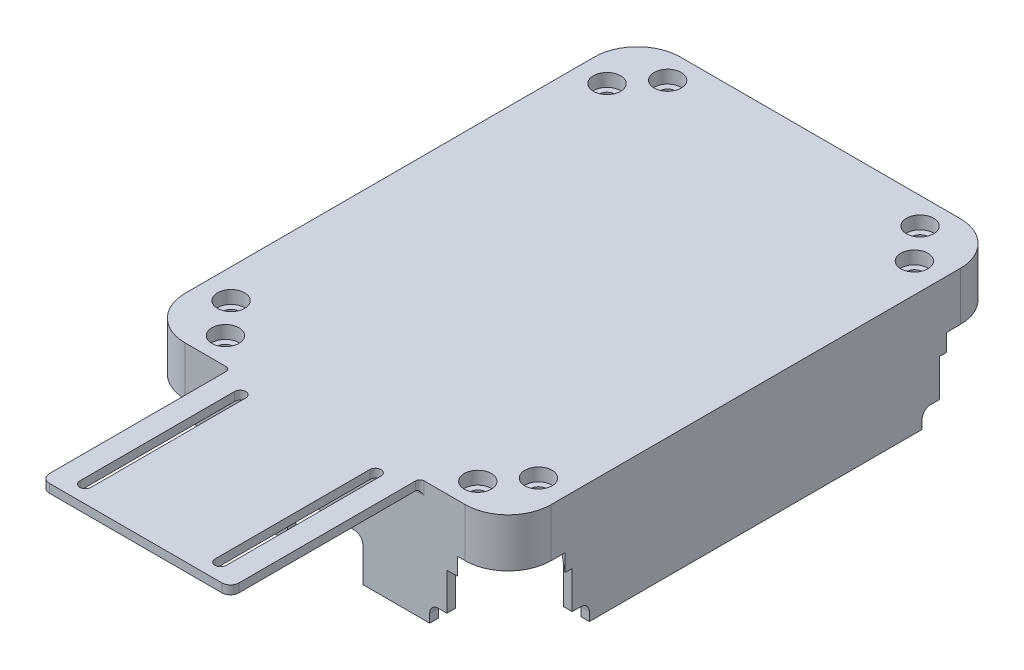
from build123d import *

# Parameters (mm, degrees)
SKETCH1_W               = 107.95
SKETCH1_H               = 146.05
BOSS_EXTRUDE1_DEPTH     = 2.54
SKETCH13_W              = 25.4
SKETCH13_H              = 25.4
BOSS_EXTRUDE4_DEPTH     = 19.431
SKETCH2_R               = 3.302
CUT_EXTRUDE1_DEPTH      = 93.862882849
FILLET1_R               = 12.7
CUT_EXTRUDE13_DEPTH     = 5.08
SKETCH15_R              = 5.08
BOSS_EXTRUDE5_DEPTH     = 11.811
SKETCH23_R              = 2.25
CUT_EXTRUDE14_DEPTH     = 92.934228941
SKETCH24_R              = 4
CUT_EXTRUDE15_DEPTH     = 3.81
MIRROR2_COPY_1_SKETCH_R = 2.25
MIRROR2_COPY_1_DEPTH    = 92.934228941
MIRROR2_COPY_2_SKETCH_R = 4
MIRROR2_COPY_2_DEPTH    = 3.81
FILLET3_R               = 12.7
FILLET4_R               = 1.016
SKETCH27_W              = 71.841582164
SKETCH27_H              = 2.54
SKETCH27_W_2            = 2.54
SKETCH27_H_2            = 108.293882364
BOSS_EXTRUDE6_DEPTH     = 32.98825
CUT_EXTRUDE16_DEPTH     = 41.656
CUT_EXTRUDE17_DEPTH     = 136.085564266
CUT_EXTRUDE18_DEPTH     = 160.706479747
CUT_EXTRUDE19_REACH     = 161.706
SKETCH31_W              = 22.225
SKETCH31_H              = 12.7
FILLET5_R               = 2.54
BOSS_EXTRUDE7_DEPTH     = 2.54
FILLET6_R               = 1.27
FILLET7_R               = 1.27


with BuildPart() as part:
    # Sketch1 → Boss-Extrude1 (new body)
    with BuildSketch(Plane(origin=(0, 0, 0), x_dir=(1, 0, 0), z_dir=(0, 1, 0))):
        Rectangle(SKETCH1_W, SKETCH1_H)
    extrude(amount=-BOSS_EXTRUDE1_DEPTH)

    # Sketch13 → Boss-Extrude4 (add)
    with BuildSketch(Plane(origin=(0, 0, 0), x_dir=(1, 0, 0), z_dir=(0, 1, 0))):
        with Locations((41.275, -60.325)):
            Rectangle(SKETCH13_W, SKETCH13_H)
        with Locations((-41.275, -60.325)):
            Rectangle(SKETCH13_W, SKETCH13_H)
        with Locations((-41.275, 60.325)):
            Rectangle(SKETCH13_W, SKETCH13_H)
        with Locations((41.275, 60.325)):
            Rectangle(SKETCH13_W, SKETCH13_H)
    extrude(amount=-BOSS_EXTRUDE4_DEPTH)

    # Sketch2 → Cut-Extrude1 (cut, through all)
    with BuildSketch(Plane(origin=(0, 0, 0), x_dir=(1, 0, 0), z_dir=(0, 1, 0))):
        with Locations(Location((45.326413441, 55.435363088, 0), (0, 0, 90))):
            Circle(SKETCH2_R)
        with Locations(Location((37.223586559, 65.214636912, 0), (0, 0, 90))):
            Circle(SKETCH2_R)
        with Locations(Location((45.326413441, -55.435363088, 0), (0, 0, 270))):
            Circle(SKETCH2_R)
        with Locations(Location((37.223586559, -65.214636912, 0), (0, 0, 270))):
            Circle(SKETCH2_R)
        with Locations(Location((-37.223586559, 65.214636912, 0), (0, 0, 270))):
            Circle(SKETCH2_R)
        with Locations(Location((-45.326413441, 55.435363088, 0), (0, 0, 270))):
            Circle(SKETCH2_R)
        with Locations(Location((-45.326413441, -55.435363088, 0), (0, 0, 90))):
            Circle(SKETCH2_R)
        with Locations(Location((-37.223586559, -65.214636912, 0), (0, 0, 90))):
            Circle(SKETCH2_R)
    extrude(amount=-CUT_EXTRUDE1_DEPTH, mode=Mode.SUBTRACT)

    # Fillet1
    fillet1_edges = [part.edges().sort_by_distance(p)[0] for p in [
        (53.975, -9.7155, 73.025),
        (-53.975, -9.7155, 73.025),
        (-53.975, -9.7155, -73.025),
        (53.975, -9.7155, -73.025),
    ]]
    fillet(fillet1_edges, radius=FILLET1_R)

    # Sketch14 → Cut-Extrude13 (cut)
    with BuildSketch(Plane.XZ.offset(19.431)):
        Polygon((20.692003582, -28.674172721), (6.35, -45.983487389), (139.038226295, -155.925160605), (153.380229877, -138.615845937), align=None)
        Polygon((-20.692003582, -28.674172721), (-6.35, -45.983487389), (-139.038226295, -155.925160605), (-153.380229877, -138.615845937), align=None)
        Polygon((-153.380229877, 138.615845937), (-20.692003582, 28.674172721), (-6.35, 45.983487389), (-139.038226295, 155.925160605), align=None)
        Polygon((20.692003582, 28.674172721), (6.35, 45.983487389), (139.038226295, 155.925160605), (153.380229877, 138.615845937), align=None)
    extrude(amount=-CUT_EXTRUDE13_DEPTH, mode=Mode.SUBTRACT)

    # Sketch15 → Boss-Extrude5 (add)
    with BuildSketch(Plane(origin=(0, 0, 0), x_dir=(1, 0, 0), z_dir=(0, 1, 0))):
        with Locations((-45.326413441, 55.435363088)):
            Circle(SKETCH15_R)
        with Locations((45.326413441, 55.435363088)):
            Circle(SKETCH15_R)
        with Locations((37.223586559, 65.214636912)):
            Circle(SKETCH15_R)
        with Locations((45.326413441, -55.435363088)):
            Circle(SKETCH15_R)
        with Locations((37.223586559, -65.214636912)):
            Circle(SKETCH15_R)
        with Locations((-37.223586559, -65.214636912)):
            Circle(SKETCH15_R)
        with Locations((-37.223586559, 65.214636912)):
            Circle(SKETCH15_R)
        with Locations((-45.326413441, -55.435363088)):
            Circle(SKETCH15_R)
    extrude(amount=-BOSS_EXTRUDE5_DEPTH)

    # Sketch23 → Cut-Extrude14 (cut, through all)
    with BuildSketch(Plane.XZ.offset(14.351)):
        with Locations(Location((-45.326413441, -55.435363088, 0), (0, 0, 270))):
            Circle(SKETCH23_R)
        with Locations(Location((-37.223586559, -65.214636912, 0), (0, 0, 270))):
            Circle(SKETCH23_R)
    cut_extrude14 = extrude(amount=-CUT_EXTRUDE14_DEPTH, mode=Mode.SUBTRACT)

    # Sketch24 → Cut-Extrude15 (cut)
    with BuildSketch(Plane(origin=(0, 0, 0), x_dir=(1, 0, 0), z_dir=(0, 1, 0))):
        with Locations(Location((-45.326413441, 55.435363088, 0), (0, 0, 270))):
            Circle(SKETCH24_R)
        with Locations(Location((-37.223586559, 65.214636912, 0), (0, 0, 270))):
            Circle(SKETCH24_R)
    cut_extrude15 = extrude(amount=-CUT_EXTRUDE15_DEPTH, mode=Mode.SUBTRACT)

    # Mirror1: Cut-Extrude14, Cut-Extrude15 across plane
    add(cut_extrude14.mirror(Plane.XY), mode=Mode.SUBTRACT)
    add(cut_extrude15.mirror(Plane.XY), mode=Mode.SUBTRACT)

    # Mirror2: Cut-Extrude14, Cut-Extrude15 across plane
    add(cut_extrude14.mirror(Plane(origin=(0, 0, 0), x_dir=(0, 0, 1), z_dir=(1, 0, 0))), mode=Mode.SUBTRACT)
    add(cut_extrude15.mirror(Plane(origin=(0, 0, 0), x_dir=(0, 0, 1), z_dir=(1, 0, 0))), mode=Mode.SUBTRACT)

    # Mirror2 copy 1 sketch → Mirror2 copy 1 (cut, through all)
    with BuildSketch(Plane(origin=(0, -14.351, 0), x_dir=(-1, 0, 0), z_dir=(0, -1, 0))):
        with Locations(Location((-45.326413441, -55.435363088, 0), (0, 0, 270))):
            Circle(MIRROR2_COPY_1_SKETCH_R)
        with Locations(Location((-37.223586559, -65.214636912, 0), (0, 0, 270))):
            Circle(MIRROR2_COPY_1_SKETCH_R)
    extrude(amount=-MIRROR2_COPY_1_DEPTH, mode=Mode.SUBTRACT)

    # Mirror2 copy 2 sketch → Mirror2 copy 2 (cut)
    with BuildSketch(Plane(origin=(0, 0, 0), x_dir=(-1, 0, 0), z_dir=(0, 1, 0))):
        with Locations(Location((-45.326413441, 55.435363088, 0), (0, 0, 270))):
            Circle(MIRROR2_COPY_2_SKETCH_R)
        with Locations(Location((-37.223586559, 65.214636912, 0), (0, 0, 270))):
            Circle(MIRROR2_COPY_2_SKETCH_R)
    extrude(amount=-MIRROR2_COPY_2_DEPTH, mode=Mode.SUBTRACT)

    # Fillet3
    fillet3_edges = [part.edges().sort_by_distance(p)[0] for p in [
        (28.575, -8.4455, -47.625),
        (-28.575, -8.4455, -47.625),
        (-28.575, -8.4455, 47.625),
        (28.575, -8.4455, 47.625),
    ]]
    fillet(fillet3_edges, radius=FILLET3_R)

    # Fillet4
    fillet4_edges = [part.edges().sort_by_distance(p)[0] for p in [
        (45.326413441, -14.351, -52.133363088),
        (37.223586559, -14.351, -61.912636912),
        (-45.326413441, -14.351, -58.737363088),
        (-37.223586559, -14.351, -68.516636912),
        (-45.326413441, -14.351, 58.737363088),
        (-37.223586559, -14.351, 68.516636912),
        (37.223586559, -14.351, 61.912636912),
        (45.326413441, -14.351, 52.133363088),
    ]]
    fillet(fillet4_edges, radius=FILLET4_R)

    # Sketch27 → Boss-Extrude6 (add)
    with BuildSketch(Plane.XZ.offset(2.54)):
        with Locations((0, -71.755)):
            Rectangle(SKETCH27_W, SKETCH27_H)
        with Locations((0, 71.755)):
            Rectangle(SKETCH27_W, SKETCH27_H)
        with Locations((52.705, 0)):
            Rectangle(SKETCH27_W_2, SKETCH27_H_2)
        with Locations((-52.705, 0)):
            Rectangle(SKETCH27_W_2, SKETCH27_H_2)
    extrude(amount=BOSS_EXTRUDE6_DEPTH)

    # Sketch28 → Cut-Extrude16 (cut)
    with BuildSketch(Plane(origin=(0, 0, -73.025), x_dir=(-1, 0, 0), z_dir=(0, 0, -1))):
        with BuildLine():
            Line((-17.526, -35.52825), (17.526, -35.52825))
            Line((17.526, -35.52825), (29.591, -35.52825))
            Line((29.591, -35.52825), (29.591, -32.98825))
            ThreePointArc((29.591, -32.98825), (28.847051224, -31.192198776), (27.051, -30.44825))
            Line((27.051, -30.44825), (19.431, -30.44825))
            ThreePointArc((19.431, -30.44825), (17.634948776, -29.704301224), (16.891, -27.90825))
            Line((16.891, -27.90825), (16.891, -20.60575))
            ThreePointArc((16.891, -20.60575), (16.147051224, -18.809698776), (14.351, -18.06575))
            Line((14.351, -18.06575), (-14.351, -18.06575))
            ThreePointArc((-14.351, -18.06575), (-16.147051224, -18.809698776), (-16.891, -20.60575))
            Line((-16.891, -20.60575), (-16.891, -27.90825))
            ThreePointArc((-16.891, -27.90825), (-17.634948776, -29.704301224), (-19.431, -30.44825))
            Line((-19.431, -30.44825), (-27.051, -30.44825))
            ThreePointArc((-27.051, -30.44825), (-28.847051224, -31.192198776), (-29.591, -32.98825))
            Line((-29.591, -32.98825), (-29.591, -35.52825))
            Line((-29.591, -35.52825), (-17.526, -35.52825))
        make_face()
    extrude(amount=-CUT_EXTRUDE16_DEPTH, mode=Mode.SUBTRACT)

    # Sketch29 → Cut-Extrude17 (cut, through all)
    with BuildSketch(Plane.ZY.offset(53.975)):
        with BuildLine():
            Line((-54.146941182, -35.52825), (-49.066941182, -35.52825))
            Line((-49.066941182, -35.52825), (-49.066941182, -32.98825))
            ThreePointArc((-49.066941182, -32.98825), (-49.810889958, -31.192198776), (-51.606941182, -30.44825))
            Line((-51.606941182, -30.44825), (-54.146941182, -30.44825))
            Line((-54.146941182, -30.44825), (-54.146941182, -35.52825))
        make_face()
        with BuildLine():
            Line((49.066941182, -35.52825), (49.066941182, -32.98825))
            ThreePointArc((49.066941182, -32.98825), (49.810889958, -31.192198776), (51.606941182, -30.44825))
            Line((51.606941182, -30.44825), (54.146941182, -30.44825))
            Line((54.146941182, -30.44825), (54.146941182, -35.52825))
            Line((54.146941182, -35.52825), (49.066941182, -35.52825))
        make_face()
    extrude(amount=-CUT_EXTRUDE17_DEPTH, mode=Mode.SUBTRACT)

    # Sketch30 → Cut-Extrude18 (cut, through all)
    with BuildSketch(Plane.XY.offset(73.025)):
        with BuildLine():
            Line((-35.920791082, -35.52825), (-30.840791082, -35.52825))
            Line((-30.840791082, -35.52825), (-30.840791082, -32.98825))
            ThreePointArc((-30.840791082, -32.98825), (-31.584739858, -31.192198776), (-33.380791082, -30.44825))
            Line((-33.380791082, -30.44825), (-35.920791082, -30.44825))
            Line((-35.920791082, -30.44825), (-35.920791082, -35.52825))
        make_face()
        with BuildLine():
            Line((30.840791082, -35.52825), (30.840791082, -32.98825))
            ThreePointArc((30.840791082, -32.98825), (31.584739858, -31.192198776), (33.380791082, -30.44825))
            Line((33.380791082, -30.44825), (35.920791082, -30.44825))
            Line((35.920791082, -30.44825), (35.920791082, -35.52825))
            Line((35.920791082, -35.52825), (30.840791082, -35.52825))
        make_face()
    extrude(amount=-CUT_EXTRUDE18_DEPTH, mode=Mode.SUBTRACT)

    # Sketch31 → Cut-Extrude19 (cut, up to next)
    with BuildSketch(Plane.XY.offset(73.025), mode=Mode.PRIVATE) as cut_extrude19_sk1:
        with Locations((0, -29.17825)):
            Rectangle(SKETCH31_W, SKETCH31_H)
    cut_extrude19_tool1 = extrude(cut_extrude19_sk1.sketch, amount=-CUT_EXTRUDE19_REACH, mode=Mode.PRIVATE) & part.part
    add(cut_extrude19_tool1.solids().sort_by_distance((0, -29.17825, 73.025))[0], mode=Mode.SUBTRACT)

    # Fillet5
    fillet5_edges = [part.edges().sort_by_distance(p)[0] for p in [
        (-11.1125, -22.82825, 71.755),
        (11.1125, -22.82825, 71.755),
    ]]
    fillet(fillet5_edges, radius=FILLET5_R)

    # Sketch33 → Boss-Extrude7 (add)
    with BuildSketch(Plane(origin=(0, 0, 0), x_dir=(1, 0, 0), z_dir=(0, 1, 0))):
        with BuildLine():
            Line((-27.94, -73.025), (0, -73.025))
            Line((0, -73.025), (27.94, -73.025))
            Line((27.94, -73.025), (27.94, -100.965))
            Line((27.94, -100.965), (27.94, -126.365))
            ThreePointArc((27.94, -126.365), (27.196051224, -128.161051224), (25.4, -128.905))
            Line((25.4, -128.905), (0, -128.905))
            Line((0, -128.905), (-25.4, -128.905))
            ThreePointArc((-25.4, -128.905), (-27.196051224, -128.161051224), (-27.94, -126.365))
            Line((-27.94, -126.365), (-27.94, -100.965))
            Line((-27.94, -100.965), (-27.94, -73.025))
        make_face()
        with BuildLine():
            Line((-18.288, -78.138531527), (-18.288, -123.791468473))
            ThreePointArc((-18.288, -123.791468473), (-19.939, -125.442468473), (-21.59, -123.791468473))
            Line((-21.59, -123.791468473), (-21.59, -78.138531527))
            ThreePointArc((-21.59, -78.138531527), (-19.939, -76.487531527), (-18.288, -78.138531527))
        make_face(mode=Mode.SUBTRACT)
        with BuildLine():
            Line((18.288, -78.138531527), (18.288, -123.791468473))
            ThreePointArc((18.288, -123.791468473), (19.939, -125.442468473), (21.59, -123.791468473))
            Line((21.59, -123.791468473), (21.59, -78.138531527))
            ThreePointArc((21.59, -78.138531527), (19.939, -76.487531527), (18.288, -78.138531527))
        make_face(mode=Mode.SUBTRACT)
    extrude(amount=-BOSS_EXTRUDE7_DEPTH)

    # Fillet6
    fillet6_edges = [part.edges().sort_by_distance(p)[0] for p in [
        (0, -2.54, 73.025),
    ]]
    fillet(fillet6_edges, radius=FILLET6_R)

    # Fillet7
    fillet7_edges = [part.edges().sort_by_distance(p)[0] for p in [
        (27.94, -1.905, 73.025),
        (-27.94, -1.905, 73.025),
    ]]
    fillet(fillet7_edges, radius=FILLET7_R)


solid = part.part
